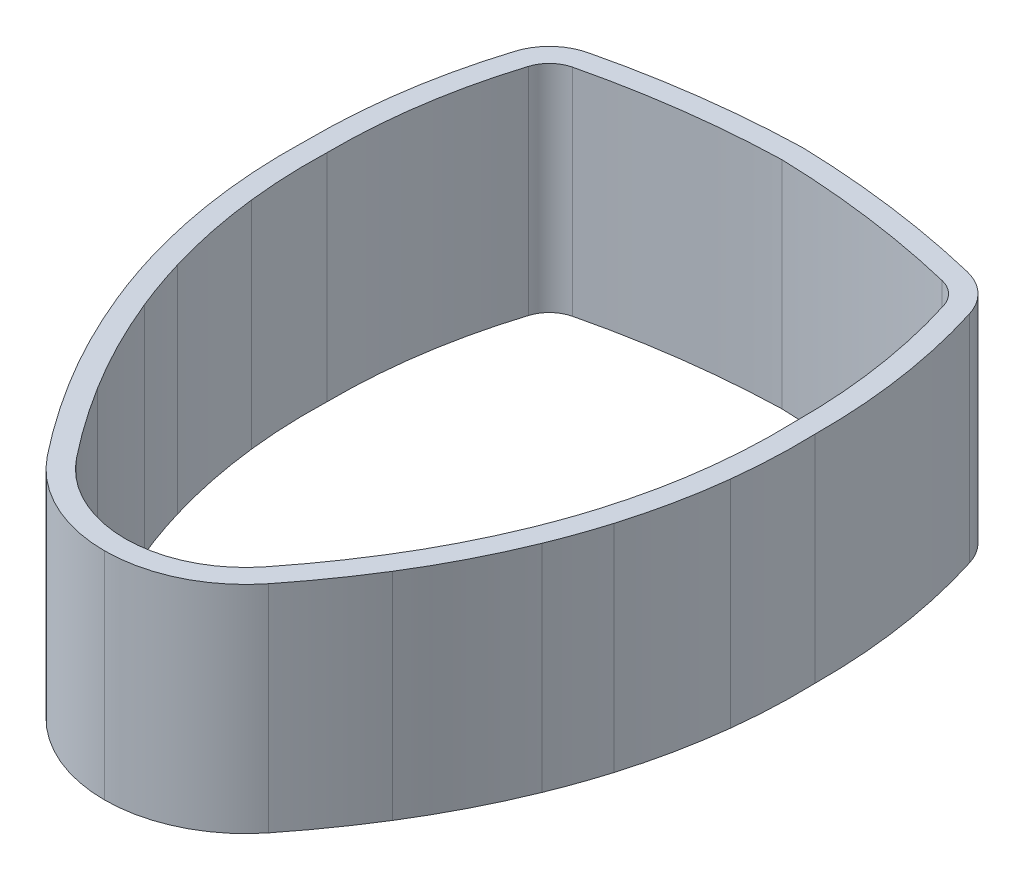
from build123d import *

# Parameters (mm, degrees)
EXTRUDE_THIN1_DEPTH = 32.893


with BuildPart() as part:
    # Sketch1 → Extrude-Thin1 (new body)
    with BuildSketch(Plane(origin=(0, 0, 0), x_dir=(1, 0, 0), z_dir=(0, 1, 0))):
        with BuildLine():
            ThreePointArc((16.859690416, 4.188302755), (20.925357953, 9.624263697), (24.673792776, 15.283641778))
            ThreePointArc((24.673792776, 15.283641778), (28.835872744, 22.655056116), (32.358402849, 30.352616811))
            ThreePointArc((32.358402849, 30.352616811), (33.886605852, 34.379502928), (35.21947344, 38.475193372))
            ThreePointArc((35.21947344, 38.475193372), (37.058530457, 45.779269739), (38.249723875, 53.216521954))
            ThreePointArc((38.249723875, 53.216521954), (38.73447294, 59.406515206), (38.763430781, 65.615392687))
            ThreePointArc((38.763430781, 65.615392687), (37.788410014, 79.600485429), (34.645449796, 93.262669938))
            ThreePointArc((34.645449796, 93.262669938), (32.487336087, 96.704142568), (28.913228351, 98.634671649))
            ThreePointArc((28.913228351, 98.634671649), (14.556820296, 101.307748109), (0, 102.469975666))
            ThreePointArc((0, 102.469975666), (-14.556820296, 101.307748109), (-28.913228351, 98.634671649))
            ThreePointArc((-28.913228351, 98.634671649), (-32.487336087, 96.704142568), (-34.645449796, 93.262669938))
            ThreePointArc((-34.645449796, 93.262669938), (-37.788410014, 79.600485429), (-38.763430781, 65.615392687))
            ThreePointArc((-38.763430781, 65.615392687), (-38.73447294, 59.406515206), (-38.249723875, 53.216521954))
            ThreePointArc((-38.249723875, 53.216521954), (-37.058530457, 45.779269739), (-35.21947344, 38.475193372))
            ThreePointArc((-35.21947344, 38.475193372), (-33.886605846, 34.37950291), (-32.358402835, 30.352616775))
            ThreePointArc((-32.358402835, 30.352616775), (-28.835872735, 22.655056099), (-24.673792776, 15.283641778))
            ThreePointArc((-24.673792776, 15.283641778), (-20.925357849, 9.62426355), (-16.859690192, 4.188302473))
            ThreePointArc((-16.859690192, 4.188302473), (-9.362082274, -1.817051595), (0, -3.968752666))
            ThreePointArc((0, -3.968752666), (9.362082435, -1.817051517), (16.859690416, 4.188302755))
        make_face()
        with BuildLine():
            ThreePointArc((14.372541639, 6.161806229), (18.329513357, 11.452436511), (21.9777336, 16.960510859))
            ThreePointArc((21.9777336, 16.960510859), (26.007427238, 24.097457247), (29.417913618, 31.550176027))
            ThreePointArc((29.417913618, 31.550176027), (30.891950162, 35.434331017), (32.177574869, 39.384851595))
            ThreePointArc((32.177574869, 39.384851595), (33.948557442, 46.418560629), (35.095657703, 53.580515883))
            ThreePointArc((35.095657703, 53.580515883), (35.563525818, 59.570235573), (35.587965764, 65.578150788))
            ThreePointArc((35.587965764, 65.578150788), (34.652553918, 79.102488225), (31.615324304, 92.314525718))
            ThreePointArc((31.615324304, 92.314525718), (30.317885926, 94.385927862), (28.167840685, 95.548407388))
            ThreePointArc((28.167840685, 95.548407388), (14.1814691, 98.154719953), (0, 99.29375))
            ThreePointArc((0, 99.29375), (-14.1814691, 98.154719953), (-28.167840685, 95.548407388))
            ThreePointArc((-28.167840685, 95.548407388), (-30.317885926, 94.385927862), (-31.615324304, 92.314525718))
            ThreePointArc((-31.615324304, 92.314525718), (-34.652553918, 79.102488225), (-35.587965764, 65.578150788))
            ThreePointArc((-35.587965764, 65.578150788), (-35.563525818, 59.570235573), (-35.095657703, 53.580515883))
            ThreePointArc((-35.095657703, 53.580515883), (-33.948557442, 46.418560629), (-32.177574869, 39.384851595))
            ThreePointArc((-32.177574869, 39.384851595), (-30.891950162, 35.434331017), (-29.417913618, 31.550176027))
            ThreePointArc((-29.417913618, 31.550176027), (-26.007427238, 24.097457247), (-21.9777336, 16.960510859))
            ThreePointArc((-21.9777336, 16.960510859), (-18.329513357, 11.452436511), (-14.372541639, 6.161806229))
            ThreePointArc((-14.372541639, 6.161806229), (-7.981004402, 1.041838599), (0, -0.79375))
            ThreePointArc((0, -0.79375), (7.981004402, 1.041838599), (14.372541639, 6.161806229))
        make_face(mode=Mode.SUBTRACT)
    extrude(amount=EXTRUDE_THIN1_DEPTH)


solid = part.part
